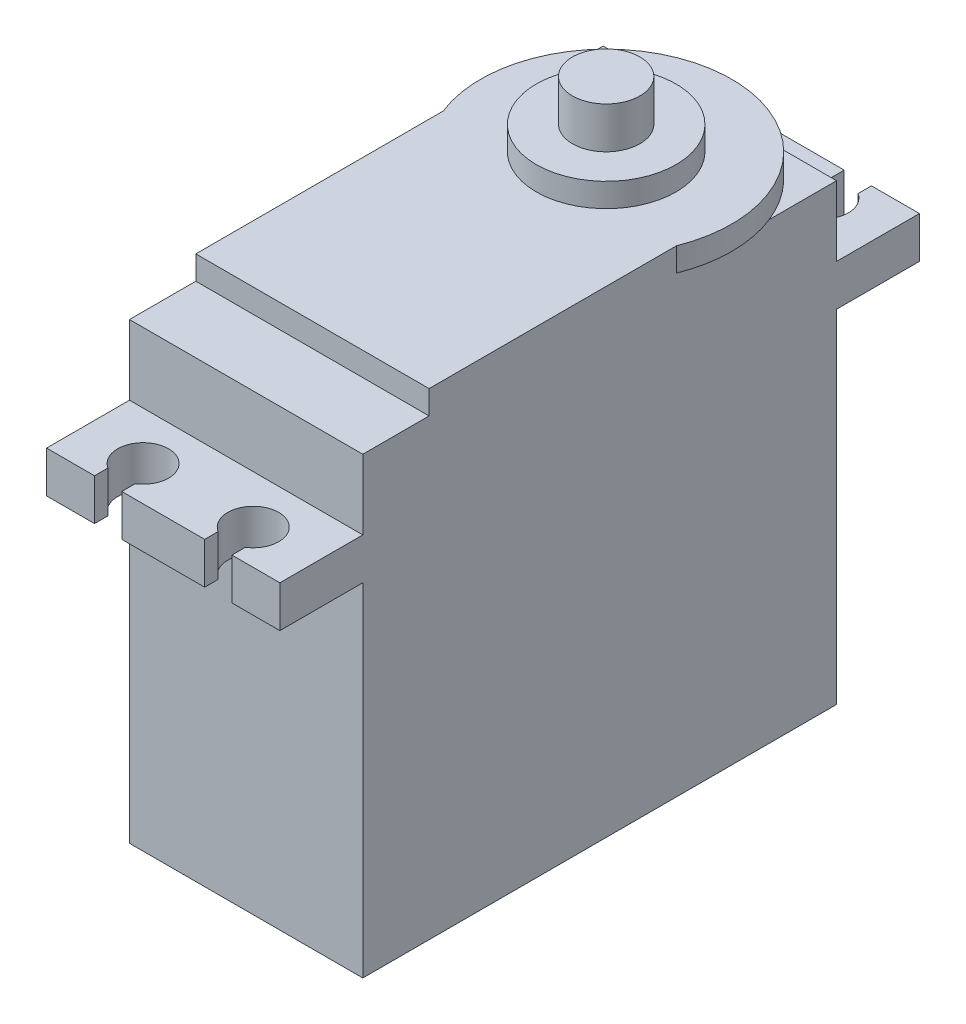
from build123d import *

# Parameters (mm, degrees)
CROQUIS1_W              = 40
CROQUIS1_H              = 38.3
SALIENTE_EXTRUIR1_DEPTH = 19.7
SALIENTE_EXTRUIR2_DEPTH = 2
CROQUIS3_R              = 5.9
SALIENTE_EXTRUIR3_DEPTH = 2
CROQUIS4_R              = 2.85
SALIENTE_EXTRUIR4_DEPTH = 3.5
SALIENTE_EXTRUIR5_DEPTH = 3.5


with BuildPart() as part:
    # Croquis1 → Saliente-Extruir1 (new body)
    with BuildSketch(Plane(origin=(0, 0, 0), x_dir=(0, 0, -1), z_dir=(1, 0, 0))):
        with Locations((20, 19.15)):
            Rectangle(CROQUIS1_W, CROQUIS1_H)
    extrude(amount=SALIENTE_EXTRUIR1_DEPTH)

    # Croquis2 → Saliente-Extruir2 (add)
    with BuildSketch(Plane(origin=(0, 38.3, 0), x_dir=(1, 0, 0), z_dir=(0, 1, 0))):
        with BuildLine():
            Line((0, 5.6), (19.7, 5.6))
            Line((19.7, 5.6), (19.7, 26.483687959))
            ThreePointArc((19.7, 26.483687959), (9.85, 41), (0, 26.483687959))
            Line((0, 26.483687959), (0, 5.6))
        make_face()
    extrude(amount=SALIENTE_EXTRUIR2_DEPTH)

    # Croquis3 → Saliente-Extruir3 (add)
    with BuildSketch(Plane(origin=(0, 40.3, 0), x_dir=(1, 0, 0), z_dir=(0, 1, 0))):
        with Locations(Location((9.85, 30.4, 0), (0, 0, 270))):
            Circle(CROQUIS3_R)
    extrude(amount=SALIENTE_EXTRUIR3_DEPTH)

    # Croquis4 → Saliente-Extruir4 (add)
    with BuildSketch(Plane(origin=(0, 42.3, 0), x_dir=(1, 0, 0), z_dir=(0, 1, 0))):
        with Locations(Location((9.85, 30.4, 0), (0, 0, 270))):
            Circle(CROQUIS4_R)
    extrude(amount=SALIENTE_EXTRUIR4_DEPTH)

    # Croquis5 → Saliente-Extruir5 (add)
    with BuildSketch(Plane(origin=(0, 32.4, 0), x_dir=(1, 0, 0), z_dir=(0, 1, 0))):
        with BuildLine():
            Line((0, 0), (19.7, 0))
            Line((19.7, 0), (19.7, -7))
            Line((19.7, -7), (15.65, -7))
            Line((15.65, -7), (15.65, -5.866590212))
            ThreePointArc((15.65, -5.866590212), (14.5, -1.9), (13.35, -5.866590212))
            Line((13.35, -5.866590212), (13.35, -7))
            Line((13.35, -7), (6.35, -7))
            Line((6.35, -7), (6.35, -5.866590212))
            ThreePointArc((6.35, -5.866590212), (5.2, -1.9), (4.05, -5.866590212))
            Line((4.05, -5.866590212), (4.05, -7))
            Line((4.05, -7), (0, -7))
            Line((0, -7), (0, 0))
        make_face()
        with BuildLine():
            Line((0, 40), (19.7, 40))
            Line((19.7, 40), (19.7, 47))
            Line((19.7, 47), (15.65, 47))
            Line((15.65, 47), (15.65, 45.866590212))
            ThreePointArc((15.65, 45.866590212), (14.5, 41.9), (13.35, 45.866590212))
            Line((13.35, 45.866590212), (13.35, 47))
            Line((13.35, 47), (6.35, 47))
            Line((6.35, 47), (6.35, 45.866590212))
            ThreePointArc((6.35, 45.866590212), (5.2, 41.9), (4.05, 45.866590212))
            Line((4.05, 45.866590212), (4.05, 47))
            Line((4.05, 47), (0, 47))
            Line((0, 47), (0, 40))
        make_face()
    extrude(amount=-SALIENTE_EXTRUIR5_DEPTH)


solid = part.part
